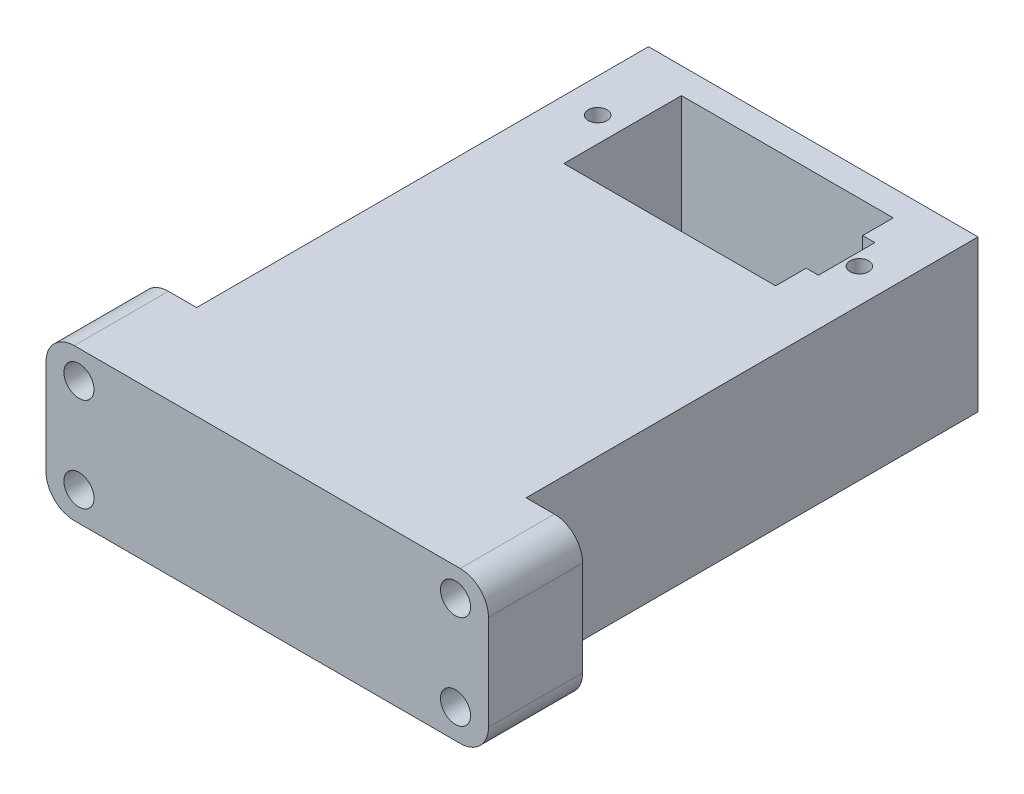
from build123d import *

# Parameters (mm, degrees)
SKETCH_2_W          = 35
SKETCH_2_H          = 18
SKETCH_2_W_2        = 22.5
SKETCH_2_H_2        = 12.5
EXTRUDE_1_DEPTH     = 16.1
SKETCH_3_R          = 1
CUT_EXTRUDE_1_DEPTH = 26.425577673
SKETCH_8_W          = 1.3
SKETCH_8_H          = 6
CUT_EXTRUDE_2_DEPTH = 26.425577673
SKETCH_9_W          = 6
SKETCH_9_H          = 16.1
SKETCH_9_R          = 1.6
EXTRUDE_4_DEPTH     = 10
EXTRUDE_4_2_DEPTH   = 10
SKETCH_10_W         = 35
SKETCH_10_H         = 16.1
EXTRUDE_5_DEPTH     = 40
FILLET_1_R          = 3


with BuildPart() as part:
    # 草图2 → 凸台-拉伸1 (new body)
    with BuildSketch(Plane(origin=(0, 0, 0), x_dir=(1, 0, 0), z_dir=(0, 1, 0))):
        Rectangle(SKETCH_2_W, SKETCH_2_H)
        Rectangle(SKETCH_2_W_2, SKETCH_2_H_2, mode=Mode.SUBTRACT)
    extrude(amount=EXTRUDE_1_DEPTH)

    # 草图3 → 切除-拉伸1 (cut, through all)
    with BuildSketch(Plane(origin=(0, 16.1, 0), x_dir=(1, 0, 0), z_dir=(0, 1, 0))):
        with Locations(Location((-13.9, 0, 0), (0, 0, 270))):
            Circle(SKETCH_3_R)
        with Locations(Location((13.9, 0, 0), (0, 0, 270))):
            Circle(SKETCH_3_R)
    extrude(amount=-CUT_EXTRUDE_1_DEPTH, mode=Mode.SUBTRACT)

    # 草图8 → 切除-拉伸2 (cut, through all)
    with BuildSketch(Plane(origin=(0, 16.1, 0), x_dir=(1, 0, 0), z_dir=(0, 1, 0))):
        with Locations((11.9, 0)):
            Rectangle(SKETCH_8_W, SKETCH_8_H)
    extrude(amount=-CUT_EXTRUDE_2_DEPTH, mode=Mode.SUBTRACT)



with BuildPart() as body_2:
    # 草图9 → 凸台-拉伸4 (new body)
    with BuildSketch(Plane.XY.offset(49)):
        with Locations((20.5, 8.05)):
            Rectangle(SKETCH_9_W, SKETCH_9_H)
        with Locations((20, 3.1)):
            Circle(SKETCH_9_R, mode=Mode.SUBTRACT)
        with Locations((20, 13.1)):
            Circle(SKETCH_9_R, mode=Mode.SUBTRACT)
    extrude(amount=-EXTRUDE_4_DEPTH)


with BuildPart() as body_3:
    # 草图9 → Extrude 4 2 (new body)
    with BuildSketch(Plane.XY.offset(49)):
        with Locations((-20.5, 8.05)):
            Rectangle(SKETCH_9_W, SKETCH_9_H)
        with Locations((-20, 3.1)):
            Circle(SKETCH_9_R, mode=Mode.SUBTRACT)
        with Locations((-20, 13.1)):
            Circle(SKETCH_9_R, mode=Mode.SUBTRACT)
    extrude(amount=-EXTRUDE_4_2_DEPTH)


with BuildPart() as part_1:
    add(part.part)

    add(body_2.part)  # 凸台-拉伸5 merges body 2

    add(body_3.part)  # 凸台-拉伸5 merges body 3
    # 草图10 → 凸台-拉伸5 (add)
    with BuildSketch(Plane.XY.offset(49)):
        with Locations((0, 8.05)):
            Rectangle(SKETCH_10_W, SKETCH_10_H)
    extrude(amount=-EXTRUDE_5_DEPTH)

    # 圆角1
    fillet_1_edges = [part_1.edges().sort_by_distance(p)[0] for p in [
        (23.5, 16.1, 44),
        (23.5, 0, 44),
        (-23.5, 16.1, 44),
        (-23.5, 0, 44),
    ]]
    fillet(fillet_1_edges, radius=FILLET_1_R)


solid = part_1.part
